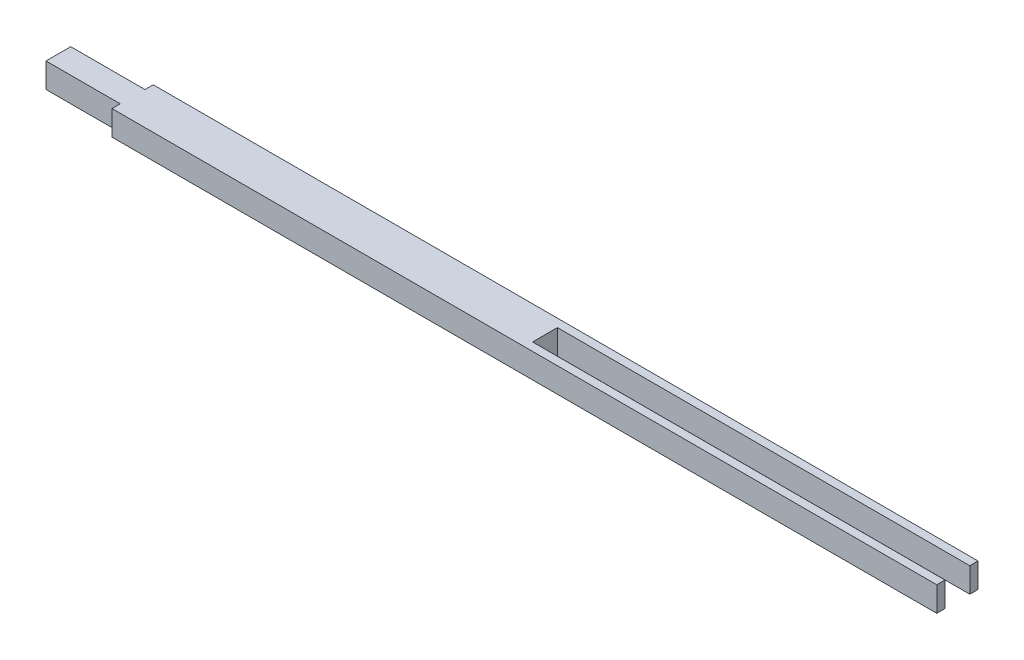
from build123d import *

# Parameters (mm, degrees)
SKETCH1_W           = 100
SKETCH1_H           = 5
BOSS_EXTRUDE1_DEPTH = 3
SKETCH2_W           = 50
SKETCH2_H           = 3.01
CUT_EXTRUDE1_DEPTH  = 3
SKETCH3_W           = 18
SKETCH3_H           = 3
BOSS_EXTRUDE2_DEPTH = 3


with BuildPart() as part:
    # Sketch1 → Boss-Extrude1 (new body)
    with BuildSketch(Plane(origin=(0, 0, 0), x_dir=(1, 0, 0), z_dir=(0, 1, 0))):
        Rectangle(SKETCH1_W, SKETCH1_H)
    extrude(amount=BOSS_EXTRUDE1_DEPTH)

    # Sketch2 → Cut-Extrude1 (cut)
    with BuildSketch(Plane(origin=(0, 3, 0), x_dir=(1, 0, 0), z_dir=(0, 1, 0))):
        with Locations((25, 0)):
            Rectangle(SKETCH2_W, SKETCH2_H)
    extrude(amount=-CUT_EXTRUDE1_DEPTH, mode=Mode.SUBTRACT)

    # Sketch3 → Boss-Extrude2 (add)
    with BuildSketch(Plane(origin=(0, 3, 0), x_dir=(1, 0, 0), z_dir=(0, 1, 0))):
        with Locations((-50, 0)):
            Rectangle(SKETCH3_W, SKETCH3_H)
    extrude(amount=-BOSS_EXTRUDE2_DEPTH)


solid = part.part
